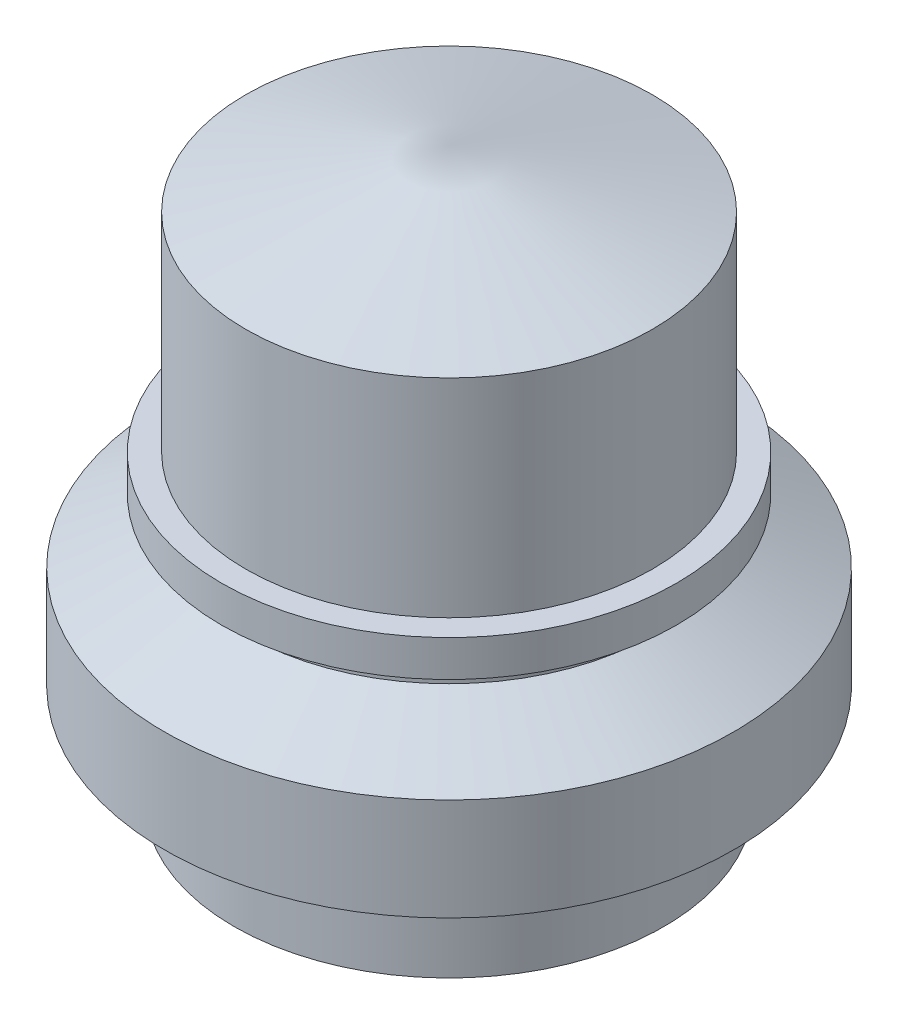
from build123d import *


with BuildPart() as part:
    # Croquis1 → Revolución1 (revolve)
    with BuildSketch(Plane.XY, mode=Mode.PRIVATE) as revoluci_n1_sk:
        Polygon((17, 0), (0, 0), (0, 45), (16.076463452, 40.438720629), (16.076463452, 24.015669315), (17.992486105, 24.015669315), (17.992486105, 21.141635335), (16.076463452, 21.141635335), (16.076463452, 19.499330204), (22.5, 16.07786118), (22.5, 8), (17, 8), align=None)
    revolve(revoluci_n1_sk.sketch.rotate(Axis((0, 0, 0), (0, 1, 0)), 90), axis=Axis((0, 0, 0), (0, 1, 0)))


solid = part.part
